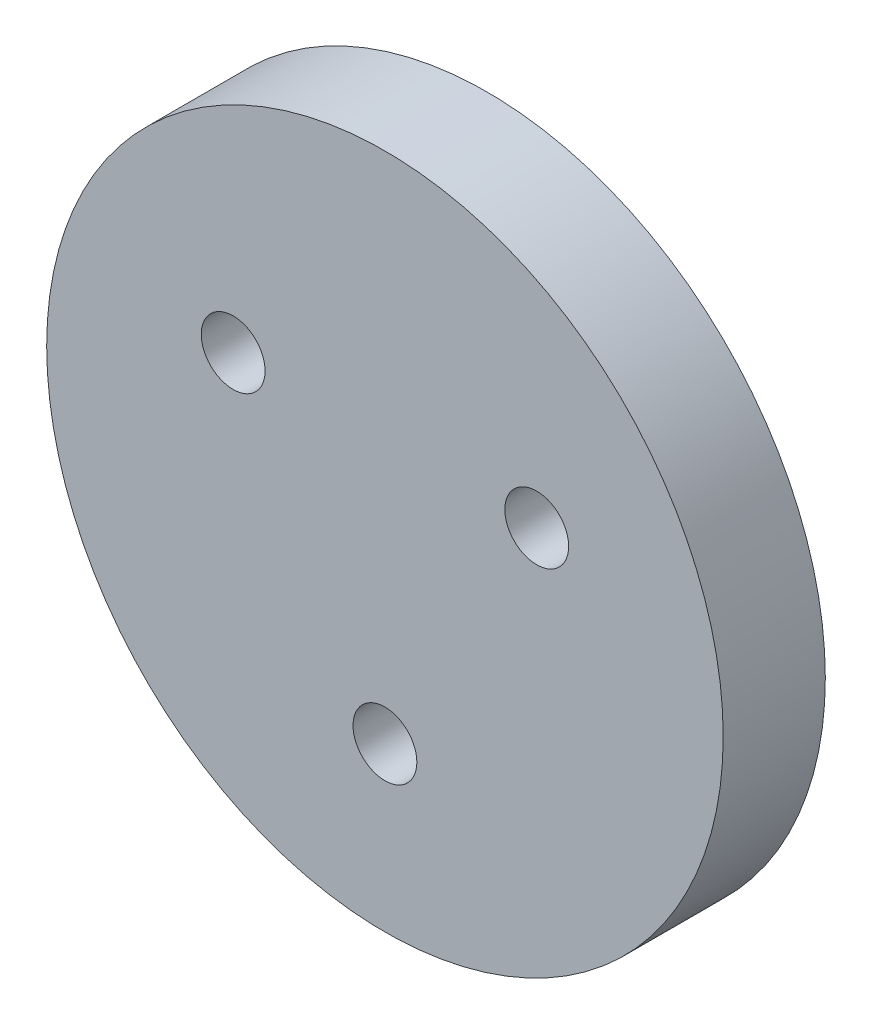
from build123d import *

# Parameters (mm, degrees)
SKETCH1_R           = 26.5
SKETCH1_R_2         = 2.5
BOSS_EXTRUDE1_DEPTH = 8


with BuildPart() as part:
    # Sketch1 → Boss-Extrude1 (new body)
    with BuildSketch(Plane.XY):
        Circle(SKETCH1_R)
        with Locations((0, -13.73)):
            Circle(SKETCH1_R_2, mode=Mode.SUBTRACT)
        with Locations((-11.890528794, 6.865)):
            Circle(SKETCH1_R_2, mode=Mode.SUBTRACT)
        with Locations((11.890528794, 6.865)):
            Circle(SKETCH1_R_2, mode=Mode.SUBTRACT)
    extrude(amount=BOSS_EXTRUDE1_DEPTH)


solid = part.part
